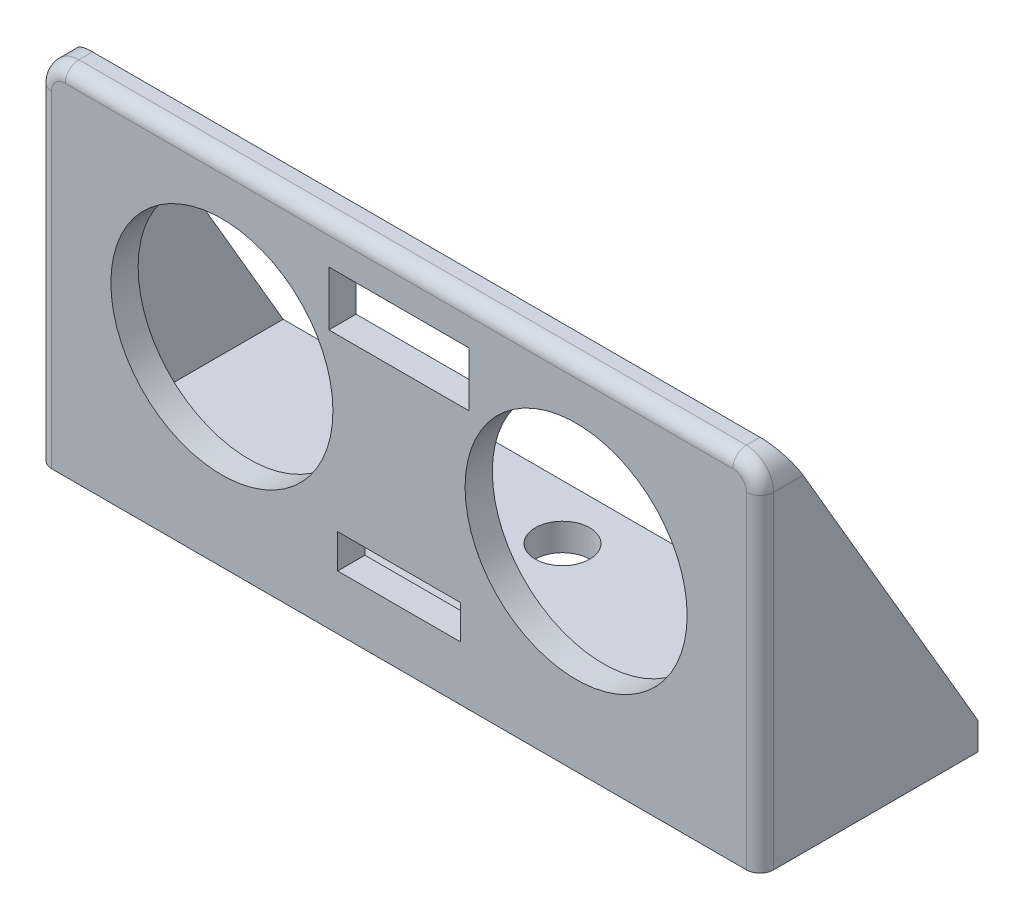
from build123d import *

# Parameters (mm, degrees)
CROQUIS1_W              = 53
CROQUIS1_H              = 24
CROQUIS1_R              = 8.15
CROQUIS1_W_2            = 10.3
CROQUIS1_H_2            = 4
CROQUIS1_W_3            = 9
CROQUIS1_H_3            = 2.5
SALIENTE_EXTRUIR1_DEPTH = 2
CROQUIS2_W              = 53
CROQUIS2_H              = 2
SALIENTE_EXTRUIR2_DEPTH = 16
SALIENTE_EXTRUIR3_DEPTH = 2
SALIENTE_EXTRUIR5_START = -53
SALIENTE_EXTRUIR5_DEPTH = 2
CROQUIS5_R              = 1.65
CROQUIS5_R_2            = 2
CORTAR_EXTRUIR1_DEPTH   = 2
REDONDEO1_R             = 2
REDONDEO6_R             = 1


with BuildPart() as part:
    # Croquis1 → Saliente-Extruir1 (new body)
    with BuildSketch(Plane.XY):
        with Locations((26.5, 12)):
            Rectangle(CROQUIS1_W, CROQUIS1_H)
        with Locations((13.5, 12)):
            Circle(CROQUIS1_R, mode=Mode.SUBTRACT)
        with Locations((39.5, 12)):
            Circle(CROQUIS1_R, mode=Mode.SUBTRACT)
        with Locations((26.5, 19)):
            Rectangle(CROQUIS1_W_2, CROQUIS1_H_2, mode=Mode.SUBTRACT)
        with Locations((26.5, 3.25)):
            Rectangle(CROQUIS1_W_3, CROQUIS1_H_3, mode=Mode.SUBTRACT)
    extrude(amount=SALIENTE_EXTRUIR1_DEPTH)

    # Croquis2 → Saliente-Extruir2 (add)
    with BuildSketch(Plane.XY.offset(2)):
        with Locations((26.5, -1)):
            Rectangle(CROQUIS2_W, CROQUIS2_H)
    extrude(amount=-SALIENTE_EXTRUIR2_DEPTH)

    # Croquis4 → Saliente-Extruir3 (add)
    with BuildSketch(Plane(origin=(53, 0, 0), x_dir=(0, 0, -1), z_dir=(1, 0, 0))):
        Polygon((14, -2), (14, 0), (0, 24), (-2, 24), (-2, -2), align=None)
    extrude(amount=-SALIENTE_EXTRUIR3_DEPTH)

    # Croquis4<3> → Saliente-Extruir5 (add)
    with BuildSketch(Plane(origin=(53, 0, 0), x_dir=(0, 0, -1), z_dir=(1, 0, 0)).offset(SALIENTE_EXTRUIR5_START)):
        Polygon((14, -2), (14, 0), (0, 24), (-2, 24), (-2, -2), align=None)
    extrude(amount=SALIENTE_EXTRUIR5_DEPTH)

    # Croquis5 → Cortar-Extruir1 (cut)
    with BuildSketch(Plane(origin=(0, 0, 0), x_dir=(1, 0, 0), z_dir=(0, 1, 0))):
        with Locations(Location((12.9, 10, 0), (0, 0, 270))):
            Circle(CROQUIS5_R)
        with Locations(Location((40.1, 10, 0), (0, 0, 270))):
            Circle(CROQUIS5_R)
        with Locations(Location((26.5, 10, 0), (0, 0, 270))):
            Circle(CROQUIS5_R_2)
    extrude(amount=-CORTAR_EXTRUIR1_DEPTH, mode=Mode.SUBTRACT)

    # Redondeo1
    redondeo1_edges = [part.edges().sort_by_distance(p)[0] for p in [
        (0, 24, 1),
        (53, 24, 1),
    ]]
    fillet(redondeo1_edges, radius=REDONDEO1_R)

    # Redondeo6
    redondeo6_edges = [part.edges().sort_by_distance(p)[0] for p in [
        (53, 10, 2),
        (0, 10, 2),
        (26.5, 24, 2),
        (52.414213562, 23.414213562, 2),
        (0.585786438, 23.414213562, 2),
    ]]
    fillet(redondeo6_edges, radius=REDONDEO6_R)


solid = part.part
